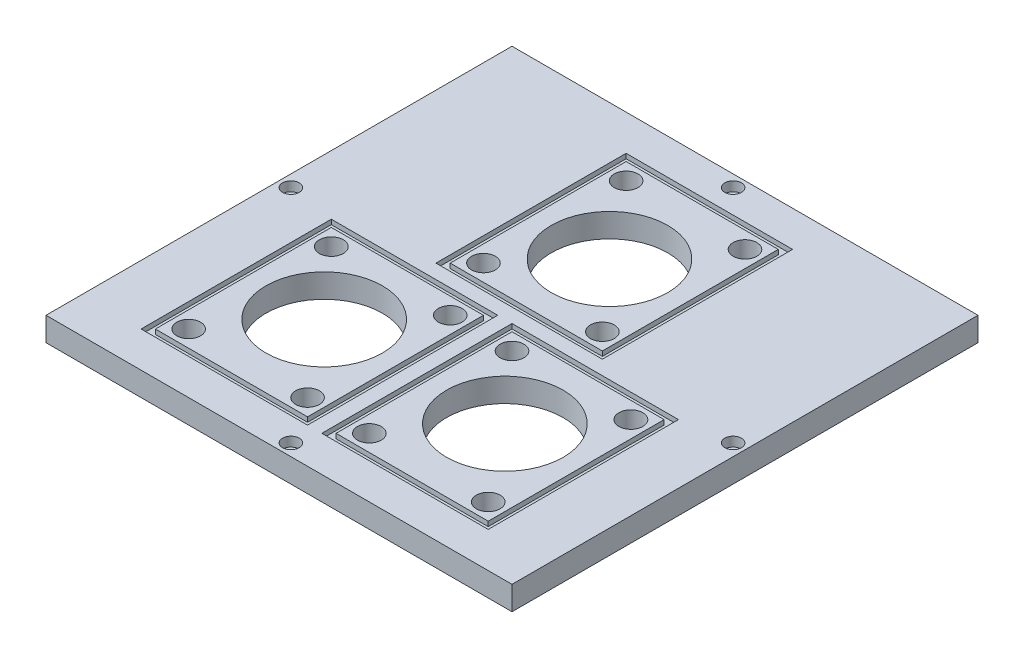
from build123d import *

# Parameters (mm, degrees)
SKETCH1_W           = 98
SKETCH1_H           = 98
BOSS_EXTRUDE2_DEPTH = 5
SKETCH6_R           = 2.5
SKETCH6_R_2         = 2.516988407
CUT_EXTRUDE11_DEPTH = 19
SKETCH9_R           = 12.25
CUT_EXTRUDE10_DEPTH = 19
SKETCH10_W          = 35
SKETCH10_H          = 40
SKETCH10_W_2        = 32
SKETCH10_H_2        = 37
CUT_EXTRUDE12_DEPTH = 1
SKETCH12_W          = 88
SKETCH12_H          = 88
SKETCH12_W_2        = 78
SKETCH12_H_2        = 78
BOSS_EXTRUDE4_DEPTH = 2
SKETCH13_R          = 1.75
CUT_EXTRUDE13_DEPTH = 2
SKETCH14_R          = 1
CUT_EXTRUDE14_DEPTH = 9


with BuildPart() as part:
    # Sketch1 → Boss-Extrude2 (new body)
    with BuildSketch(Plane(origin=(0, 0, 0), x_dir=(1, 0, 0), z_dir=(0, 1, 0))):
        Rectangle(SKETCH1_W, SKETCH1_H)
    extrude(amount=BOSS_EXTRUDE2_DEPTH)

    # Sketch6 → Cut-Extrude11 (cut)
    with BuildSketch(Plane(origin=(0, 5, 0), x_dir=(1, 0, 0), z_dir=(0, 1, 0))):
        with Locations(Location((-12.5, 36.5, 0), (0, 0, 270))):
            Circle(SKETCH6_R)
        with Locations(Location((12.5, 36.5, 0), (0, 0, 270))):
            Circle(SKETCH6_R)
        with Locations(Location((-12.5, 6.5, 0), (0, 0, 270))):
            Circle(SKETCH6_R)
        with Locations(Location((12.5, 6.5, 0), (0, 0, 270))):
            Circle(SKETCH6_R)
        with Locations(Location((-31.5, -6.5, 0), (0, 0, 270))):
            Circle(SKETCH6_R_2)
        with Locations(Location((-6.5, -6.5, 0), (0, 0, 270))):
            Circle(SKETCH6_R)
        with Locations(Location((-31.5, -36.5, 0), (0, 0, 270))):
            Circle(SKETCH6_R)
        with Locations(Location((-6.5, -36.5, 0), (0, 0, 270))):
            Circle(SKETCH6_R)
        with Locations(Location((6.5, -36.5, 0), (0, 0, 270))):
            Circle(SKETCH6_R)
        with Locations(Location((31.5, -36.5, 0), (0, 0, 270))):
            Circle(SKETCH6_R)
        with Locations(Location((6.5, -6.5, 0), (0, 0, 270))):
            Circle(SKETCH6_R)
        with Locations(Location((31.5, -6.5, 0), (0, 0, 270))):
            Circle(SKETCH6_R_2)
    extrude(amount=-CUT_EXTRUDE11_DEPTH, mode=Mode.SUBTRACT)

    # Sketch9 → Cut-Extrude10 (cut)
    with BuildSketch(Plane.XZ):
        with Locations(Location((0, -20.5, 0), (0, 0, 270))):
            Circle(SKETCH9_R)
        with Locations(Location((19, 20.5, 0), (0, 0, 270))):
            Circle(SKETCH9_R)
        with Locations(Location((-19, 20.5, 0), (0, 0, 270))):
            Circle(SKETCH9_R)
    extrude(amount=-CUT_EXTRUDE10_DEPTH, mode=Mode.SUBTRACT)

    # Sketch10 → Cut-Extrude12 (cut)
    # profile 1 of 3: a face of its own
    with BuildSketch(Plane(origin=(0, 5, 0), x_dir=(1, 0, 0), z_dir=(0, 1, 0))):
        with Locations((0, 21.5)):
            Rectangle(SKETCH10_W, SKETCH10_H)
        with Locations((0, 21.5)):
            Rectangle(SKETCH10_W_2, SKETCH10_H_2, mode=Mode.SUBTRACT)
    # profile 2 of 3: a face of its own
    with BuildSketch(Plane(origin=(0, 5, 0), x_dir=(1, 0, 0), z_dir=(0, 1, 0))):
        with Locations((-19, -21.5)):
            Rectangle(SKETCH10_W, SKETCH10_H)
        with Locations((-19, -21.5)):
            Rectangle(SKETCH10_W_2, SKETCH10_H_2, mode=Mode.SUBTRACT)
    # profile 3 of 3: a face of its own
    with BuildSketch(Plane(origin=(0, 5, 0), x_dir=(1, 0, 0), z_dir=(0, 1, 0))):
        with Locations((19, -21.5)):
            Rectangle(SKETCH10_W, SKETCH10_H)
        with Locations((19, -21.5)):
            Rectangle(SKETCH10_W_2, SKETCH10_H_2, mode=Mode.SUBTRACT)
    extrude(amount=-CUT_EXTRUDE12_DEPTH, mode=Mode.SUBTRACT)

    # Sketch12 → Boss-Extrude4 (add)
    with BuildSketch(Plane.XZ):
        Rectangle(SKETCH12_W, SKETCH12_H)
        Rectangle(SKETCH12_W_2, SKETCH12_H_2, mode=Mode.SUBTRACT)
    extrude(amount=BOSS_EXTRUDE4_DEPTH)

    # Sketch13 → Cut-Extrude13 (cut)
    with BuildSketch(Plane(origin=(0, 5, 0), x_dir=(1, 0, 0), z_dir=(0, 1, 0))):
        with BuildLine():
            ThreePointArc((0, -44.75), (-1.75, -46.5), (0, -48.25))
            Line((0, -48.25), (0, -44.75))
        make_face()
        with BuildLine():
            Line((0, -44.75), (0, -48.25))
            ThreePointArc((0, -48.25), (1.237436867, -47.737436867), (1.75, -46.5))
            ThreePointArc((1.75, -46.5), (1.237436867, -45.262563133), (0, -44.75))
        make_face()
        with Locations(Location((-46.5, 0, 0), (0, 0, 270))):
            Circle(SKETCH13_R)
        with Locations(Location((0, 46.5, 0), (0, 0, 270))):
            Circle(SKETCH13_R)
        with BuildLine():
            ThreePointArc((44.75, 0), (46.5, -1.75), (48.25, 0))
            Line((48.25, 0), (44.75, 0))
        make_face()
        with BuildLine():
            Line((44.75, 0), (48.25, 0))
            ThreePointArc((48.25, 0), (46.5, 1.75), (44.75, 0))
        make_face()
    extrude(amount=-CUT_EXTRUDE13_DEPTH, mode=Mode.SUBTRACT)

    # Sketch14 → Cut-Extrude14 (cut)
    with BuildSketch(Plane(origin=(0, 5, 0), x_dir=(1, 0, 0), z_dir=(0, 1, 0))):
        with Locations(Location((0, -46.5, 0), (0, 0, 270))):
            Circle(SKETCH14_R)
        with Locations(Location((-46.5, 0, 0), (0, 0, 270))):
            Circle(SKETCH14_R)
        with Locations(Location((46.5, 0, 0), (0, 0, 270))):
            Circle(SKETCH14_R)
        with Locations(Location((0, 46.5, 0), (0, 0, 270))):
            Circle(SKETCH14_R)
    extrude(amount=-CUT_EXTRUDE14_DEPTH, mode=Mode.SUBTRACT)


solid = part.part
